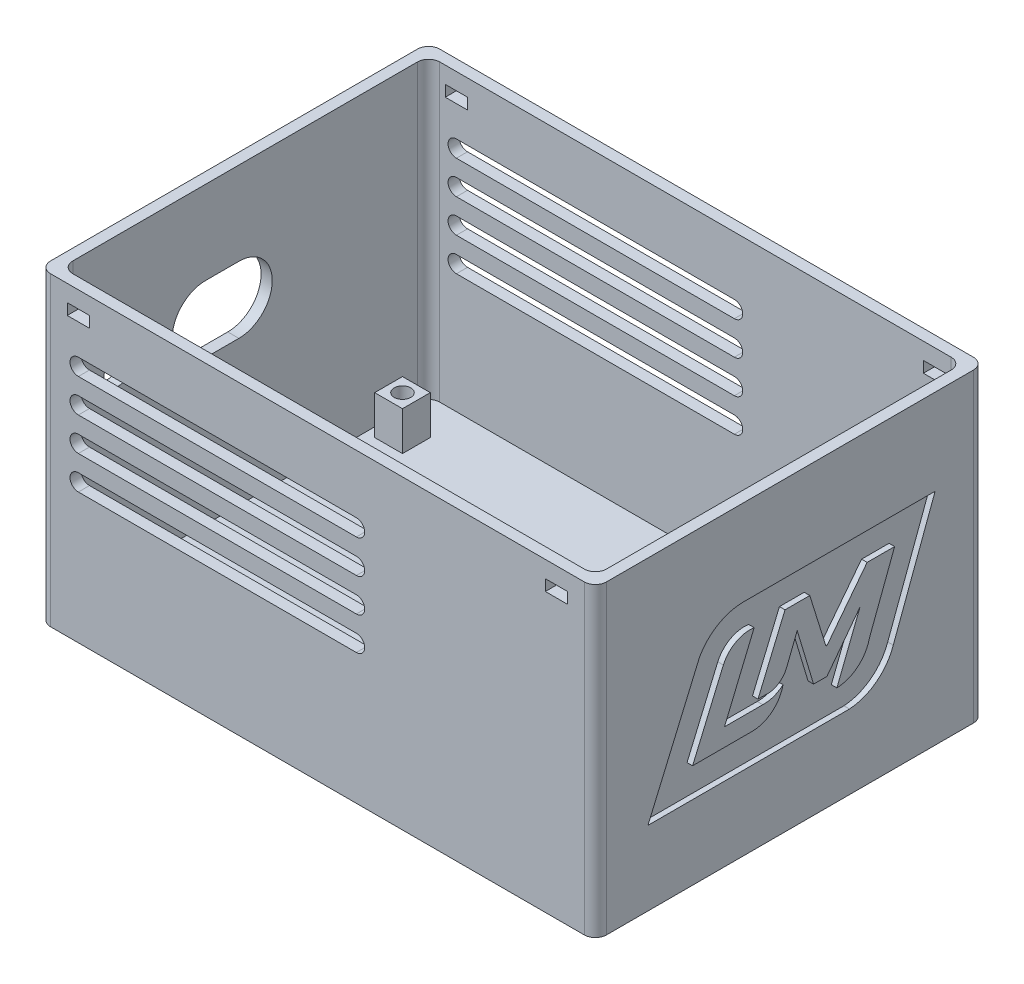
from build123d import *

# Parameters (mm, degrees)
SKETCH1_W           = 100
SKETCH1_H           = 70
BOSS_EXTRUDE1_DEPTH = 2
SKETCH3_W           = 100
SKETCH3_H           = 70
SKETCH3_W_2         = 96
SKETCH3_H_2         = 66
BOSS_EXTRUDE2_DEPTH = 55
FILLET1_R           = 2
SKETCH5_W           = 5
SKETCH5_H           = 5
BOSS_EXTRUDE3_DEPTH = 7
SKETCH6_R           = 1.5
CUT_EXTRUDE1_DEPTH  = 5
CUT_EXTRUDE2_DEPTH  = 2
BOSS_EXTRUDE4_DEPTH = 25
FILLET2_R           = 1
CUT_EXTRUDE3_DEPTH  = 103.102889283
CUT_EXTRUDE4_DEPTH  = 1
CUT_EXTRUDE5_DEPTH  = 1
SKETCH17_R          = 2.6
CUT_EXTRUDE6_DEPTH  = 2
CUT_EXTRUDE7_DEPTH  = 1
SKETCH20_W          = 4
SKETCH20_H          = 2
CUT_EXTRUDE8_DEPTH  = 103.102889332


with BuildPart() as part:
    # Sketch1 → Boss-Extrude1 (new body)
    with BuildSketch(Plane(origin=(0, 0, 0), x_dir=(1, 0, 0), z_dir=(0, 1, 0))):
        Rectangle(SKETCH1_W, SKETCH1_H)
    extrude(amount=BOSS_EXTRUDE1_DEPTH)

    # Sketch3 → Boss-Extrude2 (add)
    with BuildSketch(Plane.XZ):
        Rectangle(SKETCH3_W, SKETCH3_H)
        Rectangle(SKETCH3_W_2, SKETCH3_H_2, mode=Mode.SUBTRACT)
    extrude(amount=-BOSS_EXTRUDE2_DEPTH)

    # Fillet1
    fillet1_edges = [part.edges().sort_by_distance(p)[0] for p in [
        (48, 28.5, 33),
        (-48, 28.5, 33),
        (-48, 28.5, -33),
        (48, 28.5, -33),
        (50, 27.5, 35),
        (-50, 27.5, 35),
        (-50, 27.5, -35),
        (50, 27.5, -35),
    ]]
    fillet(fillet1_edges, radius=FILLET1_R)

    # Sketch5 → Boss-Extrude3 (add)
    with BuildSketch(Plane(origin=(0, 2, 0), x_dir=(1, 0, 0), z_dir=(0, 1, 0))):
        with Locations((-43.83, 24.13)):
            Rectangle(SKETCH5_W, SKETCH5_H)
        with Locations((25, 24.13)):
            Rectangle(SKETCH5_W, SKETCH5_H)
        with Locations((25, -24.13)):
            Rectangle(SKETCH5_W, SKETCH5_H)
        with Locations((-43.83, -24.13)):
            Rectangle(SKETCH5_W, SKETCH5_H)
    extrude(amount=BOSS_EXTRUDE3_DEPTH)

    # Sketch6 → Cut-Extrude1 (cut)
    with BuildSketch(Plane(origin=(0, 9, 0), x_dir=(1, 0, 0), z_dir=(0, 1, 0))):
        with Locations(Location((-43.83, 24.13, 0), (0, 0, 270))):
            Circle(SKETCH6_R)
        with Locations(Location((25, 24.13, 0), (0, 0, 90))):
            Circle(SKETCH6_R)
        with Locations(Location((25, -24.13, 0), (0, 0, 270))):
            Circle(SKETCH6_R)
        with Locations(Location((-43.83, -24.13, 0), (0, 0, 90))):
            Circle(SKETCH6_R)
    extrude(amount=-CUT_EXTRUDE1_DEPTH, mode=Mode.SUBTRACT)

    # Sketch7 → Cut-Extrude2 (cut)
    with BuildSketch(Plane.ZY.offset(50)):
        with BuildLine():
            Line((1.13, 40), (7.13, 40))
            ThreePointArc((7.13, 40), (13.13, 34), (7.13, 28))
            Line((7.13, 28), (1.13, 28))
            ThreePointArc((1.13, 28), (-4.87, 34), (1.13, 40))
        make_face()
    extrude(amount=-CUT_EXTRUDE2_DEPTH, mode=Mode.SUBTRACT)

    # Sketch8 → Boss-Extrude4 (add)
    with BuildSketch(Plane(origin=(0, 2, 0), x_dir=(1, 0, 0), z_dir=(0, 1, 0))):
        Polygon((31, 24.13), (48, 24.13), (48, 26.13), (29, 26.13), (29, -3.87), (48, -3.87), (48, -1.87), (31, -1.87), align=None)
    extrude(amount=BOSS_EXTRUDE4_DEPTH)

    # Fillet2
    fillet2_edges = [part.edges().sort_by_distance(p)[0] for p in [
        (29, 14.5, -26.13),
        (29, 14.5, 3.87),
        (48, 14.5, 3.87),
        (48, 14.5, 1.87),
        (31, 14.5, 1.87),
        (31, 14.5, -24.13),
        (48, 14.5, -24.13),
        (48, 14.5, -26.13),
    ]]
    fillet(fillet2_edges, radius=FILLET2_R)

    # Sketch12 → Cut-Extrude3 (cut, through all)
    with BuildSketch(Plane.XY.offset(35)):
        with BuildLine():
            Line((-43, 41.5), (7, 41.5))
            ThreePointArc((7, 41.5), (8.5, 43), (7, 44.5))
            Line((7, 44.5), (-43, 44.5))
            ThreePointArc((-43, 44.5), (-44.5, 43), (-43, 41.5))
        make_face()
        with BuildLine():
            Line((-43, 35.5), (7, 35.5))
            ThreePointArc((7, 35.5), (8.5, 37), (7, 38.5))
            Line((7, 38.5), (-43, 38.5))
            ThreePointArc((-43, 38.5), (-44.5, 37), (-43, 35.5))
        make_face()
        with BuildLine():
            Line((-43, 29.5), (7, 29.5))
            ThreePointArc((7, 29.5), (8.5, 31), (7, 32.5))
            Line((7, 32.5), (-43, 32.5))
            ThreePointArc((-43, 32.5), (-44.5, 31), (-43, 29.5))
        make_face()
        with BuildLine():
            Line((-43, 23.5), (7, 23.5))
            ThreePointArc((7, 23.5), (8.5, 25), (7, 26.5))
            Line((7, 26.5), (-43, 26.5))
            ThreePointArc((-43, 26.5), (-44.5, 25), (-43, 23.5))
        make_face()
    extrude(amount=-CUT_EXTRUDE3_DEPTH, mode=Mode.SUBTRACT)

    # Sketch13 → Cut-Extrude4 (cut)
    # profile 1 of 3: a face of its own
    with BuildSketch(Plane.ZY.offset(50)):
        Polygon((15.900385645, 25.937709976), (16.797821543, 25.937709976), (16.797821543, 21.835145874), (18.208077953, 21.835145874), (18.208077953, 20.937709976), (15.900385645, 20.937709976), align=None)
    # profile 2 of 3: a face of its own
    with BuildSketch(Plane.ZY.offset(50)):
        with BuildLine():
            add(Edge.make_bspline(
                [(21.327068338, 26.065915105), (21.413999465, 26.063664302), (21.585621201, 26.059220708), (21.838014843, 26.022179883), (22.081242784, 25.96182717), (22.315195037, 25.877932532), (22.539285814, 25.768223679), (22.754305557, 25.635810926), (22.959484075, 25.478195064), (23.152718864, 25.299053009), (23.33130266, 25.104243847), (23.486045623, 24.89449715), (23.618004745, 24.675247665), (23.727372819, 24.445907907), (23.810676964, 24.204889589), (23.869134928, 23.953421585), (23.906691273, 23.691575437), (23.911010831, 23.5132939), (23.913206158, 23.422685938)],
                knots=[0, 0, 0, 0, 1.014329547, 2.002516266, 2.970391464, 3.935626869, 4.897733899, 5.877609409, 6.878433252, 7.912639331, 8.949961323, 9.958554974, 10.949718813, 11.932905612, 12.9188844, 13.919928257, 14.942845884, 16, 16, 16, 16], degree=3))
            add(Edge.make_bspline(
                [(23.913206158, 23.422685938), (23.91086823, 23.333098919), (23.906261267, 23.156564823), (23.870668142, 22.89713169), (23.811225739, 22.648357433), (23.729334498, 22.409678945), (23.621949947, 22.182252304), (23.492564172, 21.964625422), (23.337762926, 21.758817928), (23.16319242, 21.564940267), (22.971005442, 21.388954688), (22.767448923, 21.233867701), (22.553462761, 21.10245284), (22.329360165, 20.9947703), (22.094660555, 20.911201847), (21.84994367, 20.852238231), (21.595224652, 20.816404851), (21.422003367, 20.81182798), (21.334079556, 20.809504848)],
                knots=[0, 0, 0, 0, 1.051557043, 2.072126891, 3.067553643, 4.050577992, 5.02905126, 6.015227836, 7.017913613, 8.04756643, 9.074058332, 10.072836633, 11.047628519, 12.017157415, 12.98668631, 13.966869689, 14.968021931, 16, 16, 16, 16], degree=3))
            add(Edge.make_bspline(
                [(21.334079556, 20.809504848), (21.242121791, 20.811588812), (21.061437353, 20.815683517), (20.797004869, 20.854622287), (20.5436557, 20.913277678), (20.303518126, 21.000817702), (20.07414655, 21.110250092), (19.857226233, 21.245022643), (19.652830074, 21.40491263), (19.462130523, 21.585825213), (19.289356269, 21.783783259), (19.136849099, 21.99290838), (19.008205918, 22.211603043), (18.903422019, 22.439969604), (18.820814603, 22.676588818), (18.762544457, 22.922901765), (18.728122891, 23.178317698), (18.723328166, 23.351801306), (18.720898466, 23.439713181)],
                knots=[0, 0, 0, 0, 1.067978421, 2.098431617, 3.099715153, 4.085208694, 5.062210972, 6.048429807, 7.046490867, 8.072918869, 9.098532598, 10.095778865, 11.076610158, 12.041847152, 13.011192615, 13.984257998, 14.978533688, 16, 16, 16, 16], degree=3))
            add(Edge.make_bspline(
                [(18.720898466, 23.439713181), (18.721661046, 23.498855689), (18.72317655, 23.616391825), (18.741432391, 23.790574379), (18.767715554, 23.961357123), (18.806587106, 24.128059145), (18.853806105, 24.291856448), (18.914984989, 24.451224368), (18.984623115, 24.607865393), (19.065988709, 24.759929395), (19.156459382, 24.906017258), (19.255170942, 25.045439861), (19.362371596, 25.176511381), (19.477716016, 25.300093166), (19.601601695, 25.415372903), (19.732399045, 25.523982537), (19.872644772, 25.623037012), (20.019269338, 25.714955434), (20.171446106, 25.798075669), (20.32855558, 25.868825127), (20.487360994, 25.930609423), (20.649983775, 25.979372322), (20.814681129, 26.019089193), (20.983212514, 26.045354641), (21.154055345, 26.063609977), (21.269260475, 26.065144905), (21.327068338, 26.065915105)],
                knots=[0, 0, 0, 0, 1.034744296, 2.056386356, 3.06226378, 4.057406941, 5.050368692, 6.043467995, 7.042652155, 8.049140477, 9.059438543, 10.048523776, 11.036952808, 12.020949711, 13.004946614, 13.997082645, 14.994316842, 16.007702937, 17.024872941, 18.026463647, 19.021641123, 20.005082605, 20.995858141, 21.984425357, 22.988620895, 24, 24, 24, 24], degree=3))
        make_face()
        with BuildLine():
            add(Edge.make_bspline(
                [(21.313045902, 25.168479207), (21.254541264, 25.166909396), (21.139076521, 25.163811218), (20.969710771, 25.14020729), (20.80711367, 25.102509133), (20.652186558, 25.047903814), (20.504257967, 24.978405102), (20.363065665, 24.894255834), (20.230564875, 24.792563472), (20.104988826, 24.678787427), (19.99155153, 24.552014765), (19.8913261, 24.416156298), (19.807453558, 24.271438907), (19.737209779, 24.119206982), (19.684331782, 23.957748716), (19.646668369, 23.788328829), (19.622866499, 23.610655402), (19.619866243, 23.489535658), (19.618334363, 23.427693951)],
                knots=[0, 0, 0, 0, 1.033739768, 2.040188636, 3.016340934, 3.979330865, 4.937572243, 5.900995986, 6.878200029, 7.884839167, 8.891893314, 9.879764717, 10.863503415, 11.843163062, 12.837761627, 13.859916423, 14.907309254, 16, 16, 16, 16], degree=3))
            add(Edge.make_bspline(
                [(19.618334363, 23.427693951), (19.620365402, 23.359159427), (19.624345902, 23.224843117), (19.652353184, 23.028906103), (19.700270856, 22.843863039), (19.769463042, 22.670618945), (19.855279505, 22.507250073), (19.961849933, 22.355758743), (20.087448388, 22.215237894), (20.18420842, 22.133195969), (20.233318338, 22.09155613)],
                knots=[0, 0, 0, 0, 1.078454662, 2.113592447, 3.107694534, 4.079536787, 5.043276885, 6.005368276, 6.987637804, 8, 8, 8, 8], degree=3))
            add(Edge.make_bspline(
                [(20.233318338, 22.09155613), (20.273548736, 22.060794217), (20.353103134, 21.999963461), (20.480089273, 21.921996368), (20.610859993, 21.855170792), (20.74640212, 21.801176517), (20.886429398, 21.758705528), (21.030922625, 21.728963792), (21.179677065, 21.710298281), (21.280271789, 21.708067399), (21.331074748, 21.706940746)],
                knots=[0, 0, 0, 0, 1.023928204, 2.024787132, 3.009472467, 3.9914905, 4.972207045, 5.96565515, 6.972602802, 8, 8, 8, 8], degree=3))
            add(Edge.make_bspline(
                [(21.331074748, 21.706940746), (21.388573397, 21.708523867), (21.501703797, 21.711638707), (21.667916712, 21.734952058), (21.827153733, 21.774406665), (21.980403417, 21.828532967), (22.12722386, 21.898904295), (22.26689751, 21.98566361), (22.399669254, 22.087745618), (22.525085321, 22.203015792), (22.639721534, 22.330287851), (22.739737814, 22.466870973), (22.826277084, 22.609755824), (22.895060143, 22.760964722), (22.95002723, 22.919070326), (22.987237344, 23.084772851), (23.011240286, 23.257389209), (23.014241387, 23.374860741), (23.015770261, 23.434705169)],
                knots=[0, 0, 0, 0, 1.026359118, 2.019393844, 2.989460624, 3.950973911, 4.916101784, 5.890408035, 6.881132271, 7.902007068, 8.92769091, 9.933912415, 10.920395702, 11.90457117, 12.894218921, 13.903490204, 14.931958862, 16, 16, 16, 16], degree=3))
            add(Edge.make_bspline(
                [(23.015770261, 23.434705169), (23.014188488, 23.494205474), (23.011075009, 23.611322751), (22.987720625, 23.783495314), (22.948516228, 23.948466311), (22.894227391, 24.106505158), (22.824903421, 24.257766792), (22.739177298, 24.401719286), (22.637349827, 24.538223475), (22.521764559, 24.666349133), (22.395957098, 24.784088407), (22.260890219, 24.886264693), (22.120343244, 24.975052638), (21.971091339, 25.044605528), (21.816188074, 25.100018168), (21.654688221, 25.140824832), (21.485980089, 25.163645399), (21.371204459, 25.166853575), (21.313045902, 25.168479207)],
                knots=[0, 0, 0, 0, 1.055025985, 2.07665775, 3.074803781, 4.057872707, 5.035505728, 6.020516407, 7.023567878, 8.050795229, 9.077271434, 10.074415901, 11.050397877, 12.019801805, 12.988065821, 13.964604439, 14.968634123, 16, 16, 16, 16], degree=3))
        make_face(mode=Mode.SUBTRACT)
    # profile 3 of 3: a face of its own
    with BuildSketch(Plane.ZY.offset(50)):
        with BuildLine():
            Line((29.392973786, 25.14243754), (28.713887248, 24.492397476))
            add(Edge.make_bspline(
                [(28.713887248, 24.492397476), (28.660122782, 24.546226362), (28.554628023, 24.651847522), (28.382104541, 24.789320721), (28.203422574, 24.906200117), (28.017994007, 25.002306532), (27.825560537, 25.076855023), (27.626501917, 25.130181944), (27.420494305, 25.161811045), (27.281036347, 25.166239011), (27.210481799, 25.168479207)],
                knots=[0, 0, 0, 0, 1.075575784, 2.110457258, 3.113929901, 4.09197124, 5.059417775, 6.02750972, 7.002078037, 8, 8, 8, 8], degree=3))
            add(Edge.make_bspline(
                [(27.210481799, 25.168479207), (27.149313164, 25.166909512), (27.029203186, 25.163827278), (26.852713141, 25.140421003), (26.684066093, 25.101321873), (26.522465282, 25.047156556), (26.368897337, 24.97667036), (26.222472458, 24.890951157), (26.084091744, 24.789343186), (25.954844844, 24.673772583), (25.837165126, 24.547592818), (25.734424518, 24.412535851), (25.646911592, 24.27111903), (25.574870606, 24.122618846), (25.52005525, 23.967263216), (25.480924259, 23.805164922), (25.45608581, 23.636795043), (25.453153131, 23.521931367), (25.451667697, 23.463751643)],
                knots=[0, 0, 0, 0, 1.075001177, 2.110859044, 3.123021556, 4.114053297, 5.101481495, 6.087880186, 7.091499647, 8.114004866, 9.131394192, 10.11971144, 11.092043119, 12.050101265, 13.015322563, 13.981809771, 14.977764287, 16, 16, 16, 16], degree=3))
            add(Edge.make_bspline(
                [(25.451667697, 23.463751643), (25.453053239, 23.40355824), (25.455782946, 23.284968997), (25.482004874, 23.110934184), (25.522404267, 22.943500153), (25.581538207, 22.783909226), (25.654314179, 22.629975229), (25.746606101, 22.484680011), (25.854227719, 22.345804755), (25.976986726, 22.215767358), (26.110516824, 22.095904173), (26.255134265, 21.992507105), (26.406438899, 21.903297754), (26.566872791, 21.832646831), (26.733651283, 21.77592188), (26.908465987, 21.735925922), (27.090923263, 21.71138854), (27.215412217, 21.708438102), (27.278590774, 21.706940746)],
                knots=[0, 0, 0, 0, 1.022067601, 2.013613092, 2.983553406, 3.943623673, 4.90013463, 5.87121881, 6.861774014, 7.881098904, 8.905697761, 9.905387765, 10.89678721, 11.884561068, 12.87834324, 13.885584958, 14.926927371, 16, 16, 16, 16], degree=3))
            add(Edge.make_bspline(
                [(27.278590774, 21.706940746), (27.319686085, 21.707311541), (27.400365325, 21.708039496), (27.518708021, 21.71985625), (27.632051899, 21.736749674), (27.740835909, 21.759114561), (27.843961624, 21.790764889), (27.94285689, 21.82777605), (28.036942268, 21.8714566), (28.125707636, 21.923313598), (28.210474082, 21.981438956), (28.290448175, 22.047946724), (28.367032754, 22.1213374), (28.439332938, 22.202507552), (28.506125025, 22.292182939), (28.569548866, 22.388715656), (28.628878267, 22.493063731), (28.663934445, 22.566749056), (28.681835966, 22.604376643)],
                knots=[0, 0, 0, 0, 1.109579412, 2.178351274, 3.208885622, 4.204702371, 5.174744997, 6.119429583, 7.05542196, 7.97267548, 8.893247984, 9.828544973, 10.778894627, 11.756245826, 12.760884819, 13.796418446, 14.874735809, 16, 16, 16, 16], degree=3))
            Line((28.681835966, 22.604376643), (27.246539492, 22.604376643))
            Line((27.246539492, 22.604376643), (27.246539492, 23.50181254))
            Line((27.246539492, 23.50181254), (29.739528274, 23.50181254))
            Line((29.739528274, 23.50181254), (29.746539492, 23.288471194))
            add(Edge.make_bspline(
                [(29.746539492, 23.288471194), (29.745638602, 23.233679723), (29.743838431, 23.124194562), (29.727386757, 22.961189808), (29.700134809, 22.800346975), (29.662878787, 22.641827607), (29.616187568, 22.484854112), (29.556641647, 22.330929642), (29.486913738, 22.17901033), (29.408788563, 22.029741718), (29.320998344, 21.886514426), (29.226479283, 21.750897088), (29.126578813, 21.623124427), (29.019124141, 21.504976638), (28.905788512, 21.395461226), (28.786348825, 21.294999511), (28.660382626, 21.20350649), (28.52855721, 21.120209255), (28.390121703, 21.047204143), (28.245837223, 20.983699381), (28.095921622, 20.929766127), (27.93998785, 20.885552592), (27.778342749, 20.851438332), (27.610982853, 20.828046139), (27.437816248, 20.812150881), (27.320361003, 20.810397522), (27.260561927, 20.809504848)],
                knots=[0, 0, 0, 0, 1.006889344, 2.011981806, 3.007738725, 4.003571281, 5.003404394, 6.015442001, 7.03424805, 8.074616296, 9.110249922, 10.119753985, 11.111721717, 12.089233633, 13.052717867, 14.006597561, 14.955430184, 15.912305663, 16.870361111, 17.829300583, 18.807640451, 19.796414044, 20.806216501, 21.841577364, 22.90109906, 24, 24, 24, 24], degree=3))
            add(Edge.make_bspline(
                [(27.260561927, 20.809504848), (27.196760368, 20.81038638), (27.070286647, 20.81213384), (26.8832783, 20.828499988), (26.701695181, 20.855511259), (26.525492, 20.892893936), (26.354259648, 20.939419663), (26.188292329, 20.997820456), (26.02792949, 21.067290046), (25.872690921, 21.145988852), (25.724560739, 21.235240152), (25.583870928, 21.333478916), (25.4513894, 21.441337068), (25.325759132, 21.557009039), (25.209915334, 21.683338057), (25.09954096, 21.816229187), (24.999983271, 21.960556343), (24.906961581, 22.111640399), (24.824320368, 22.269418041), (24.75204944, 22.430971091), (24.690416833, 22.595364155), (24.641818033, 22.763362704), (24.602360358, 22.933795309), (24.574127652, 23.107403144), (24.558183323, 23.284164477), (24.555554821, 23.402957248), (24.554231799, 23.46275004)],
                knots=[0, 0, 0, 0, 1.084149091, 2.14910686, 3.187506334, 4.202448172, 5.208724393, 6.201130722, 7.189831603, 8.176984443, 9.156919086, 10.126598231, 11.090766514, 12.05840148, 13.026036446, 14.001772938, 14.991905635, 16.003017641, 17.015720547, 18.016462227, 19.009322657, 19.99686681, 20.986544154, 21.980959929, 22.983742515, 24, 24, 24, 24], degree=3))
            add(Edge.make_bspline(
                [(24.554231799, 23.46275004), (24.556003608, 23.544320186), (24.559502406, 23.705397041), (24.591906585, 23.942664269), (24.642419872, 24.172196638), (24.714911525, 24.393158207), (24.807935433, 24.605853352), (24.92017383, 24.810781385), (25.054064777, 25.007724486), (25.157705565, 25.129659619), (25.210281479, 25.191516066)],
                knots=[0, 0, 0, 0, 1.034044851, 2.041932006, 3.031217818, 4.011390712, 4.986069675, 5.97149666, 6.970960976, 8, 8, 8, 8], degree=3))
            add(Edge.make_bspline(
                [(25.210281479, 25.191516066), (25.24292535, 25.227301896), (25.307722942, 25.298336229), (25.411301777, 25.39703988), (25.517507399, 25.489824965), (25.627810775, 25.574724032), (25.741632059, 25.653595563), (25.859298849, 25.724961049), (25.980193893, 25.791092805), (26.105260026, 25.848613892), (26.233842508, 25.900186345), (26.366510813, 25.943823891), (26.50227128, 25.982476385), (26.642326074, 26.01188102), (26.785260307, 26.036366956), (26.932088575, 26.052778712), (27.08241076, 26.064807361), (27.184081126, 26.065542936), (27.235521863, 26.065915105)],
                knots=[0, 0, 0, 0, 1.020590567, 2.025856924, 3.013483481, 3.991664875, 4.957826714, 5.930500614, 6.890802512, 7.860442893, 8.829981142, 9.809047939, 10.802672283, 11.803273349, 12.823572789, 13.857849586, 14.916166035, 16, 16, 16, 16], degree=3))
            add(Edge.make_bspline(
                [(27.235521863, 26.065915105), (27.289294134, 26.065085844), (27.396281209, 26.063435919), (27.555353272, 26.052019517), (27.712214922, 26.034406699), (27.866205129, 26.007986466), (28.017840684, 25.975404821), (28.166336686, 25.933659668), (28.312661887, 25.886229656), (28.407919039, 25.848414946), (28.455473786, 25.829536899)],
                knots=[0, 0, 0, 0, 1.03180557, 2.052914215, 3.058998889, 4.059601663, 5.049854447, 6.033765722, 7.018406786, 8, 8, 8, 8], degree=3))
            add(Edge.make_bspline(
                [(28.455473786, 25.829536899), (28.495485224, 25.812090186), (28.57686738, 25.776604054), (28.695268387, 25.711680511), (28.81395868, 25.639705312), (28.93165753, 25.558046877), (29.048185598, 25.466857945), (29.164759561, 25.36757883), (29.280189389, 25.25905188), (29.354892108, 25.1818124), (29.392973786, 25.14243754)],
                knots=[0, 0, 0, 0, 0.894392155, 1.819168899, 2.76525314, 3.739198753, 4.75366411, 5.797420238, 6.877176959, 8, 8, 8, 8], degree=3))
        make_face()
    extrude(amount=-CUT_EXTRUDE4_DEPTH, mode=Mode.SUBTRACT)

    # Sketch16 → Cut-Extrude5 (cut)
    with BuildSketch(Plane.ZY.offset(50)):
        with BuildLine():
            Line((13.819956959, 25.969761258), (13.819956959, 20.969761258))
            ThreePointArc((13.819956959, 20.969761258), (14.405743397, 19.555547696), (15.819956959, 18.969761258))
            Line((15.819956959, 18.969761258), (29.819956959, 18.969761258))
            ThreePointArc((29.819956959, 18.969761258), (31.234170522, 19.555547696), (31.819956959, 20.969761258))
            Line((31.819956959, 20.969761258), (31.819956959, 25.969761258))
            ThreePointArc((31.819956959, 25.969761258), (31.234170522, 27.383974821), (29.819956959, 27.969761258))
            Line((29.819956959, 27.969761258), (15.819956959, 27.969761258))
            ThreePointArc((15.819956959, 27.969761258), (14.405743397, 27.383974821), (13.819956959, 25.969761258))
        make_face()
        with BuildLine():
            Line((15.819956959, 26.969761258), (29.819956959, 26.969761258))
            ThreePointArc((29.819956959, 26.969761258), (30.527063741, 26.67686804), (30.819956959, 25.969761258))
            Line((30.819956959, 25.969761258), (30.819956959, 20.969761258))
            ThreePointArc((30.819956959, 20.969761258), (30.527063741, 20.262654477), (29.819956959, 19.969761258))
            Line((29.819956959, 19.969761258), (15.819956959, 19.969761258))
            ThreePointArc((15.819956959, 19.969761258), (15.112850178, 20.262654477), (14.819956959, 20.969761258))
            Line((14.819956959, 20.969761258), (14.819956959, 25.969761258))
            ThreePointArc((14.819956959, 25.969761258), (15.112850178, 26.67686804), (15.819956959, 26.969761258))
        make_face(mode=Mode.SUBTRACT)
    extrude(amount=-CUT_EXTRUDE5_DEPTH, mode=Mode.SUBTRACT)

    # Sketch17 → Cut-Extrude6 (cut)
    with BuildSketch(Plane.ZY.offset(50)):
        with Locations((22.819956959, 34)):
            Circle(SKETCH17_R)
    extrude(amount=-CUT_EXTRUDE6_DEPTH, mode=Mode.SUBTRACT)

    # Sketch19 → Cut-Extrude7 (cut)
    with BuildSketch(Plane(origin=(50, 0, 0), x_dir=(0, 0, -1), z_dir=(1, 0, 0))):
        with BuildLine():
            Line((26.110310784, 39.561095617), (-8.439517259, 39.561095617))
            ThreePointArc((-8.439517259, 39.561095617), (-12.962003459, 38.294937056), (-16.252914783, 34.944423425))
            Line((-16.252914783, 34.944423425), (-25.549438608, 13.342615981))
            Line((-25.549438608, 13.342615981), (10.706291518, 13.342615981))
            ThreePointArc((10.706291518, 13.342615981), (15.553853165, 15.15855546), (18.58520651, 19.354671164))
            Line((18.58520651, 19.354671164), (26.110310784, 39.561095617))
        make_face()
        with BuildLine():
            Line((-6.438114675, 34.593979897), (-11.787047742, 21.811603083))
            Line((-11.787047742, 21.811603083), (-4.904229457, 21.811603083))
            ThreePointArc((-4.904229457, 21.811603083), (-2.948777203, 22.103803393), (-1.246503169, 23.109505959))
            ThreePointArc((-1.246503169, 23.109505959), (-3.253163269, 19.865276329), (-6.855937429, 18.611590164))
            Line((-6.855937429, 18.611590164), (-17.515536588, 18.611590164))
            Line((-17.515536588, 18.611590164), (-11.983339556, 31.54253851))
            ThreePointArc((-11.983339556, 31.54253851), (-9.720527691, 33.994693133), (-6.438114675, 34.593979897))
        make_face(mode=Mode.SUBTRACT)
        with BuildLine():
            Line((-0.892509009, 34.593979897), (-5.747693063, 23.109505959))
            Line((-5.747693063, 23.109505959), (-4.518488271, 23.109505959))
            ThreePointArc((-4.518488271, 23.109505959), (-2.15228711, 23.618823786), (-0.595878861, 25.472443473))
            Line((-0.595878861, 25.472443473), (1.30215795, 30.262726854))
            Line((1.30215795, 30.262726854), (4.248634143, 20.447165059))
            Line((4.248634143, 20.447165059), (6.652814103, 20.447165059))
            Line((6.652814103, 20.447165059), (12.61452231, 28.308495829))
            Line((12.61452231, 28.308495829), (8.437925444, 17.76756088))
            ThreePointArc((8.437925444, 17.76756088), (12.191158486, 19.17915515), (14.287204196, 22.597626889))
            Line((14.287204196, 22.597626889), (18.828654002, 34.593979897))
            Line((18.828654002, 34.593979897), (13.878983989, 34.593979897))
            Line((13.878983989, 34.593979897), (6.652814103, 25.242589718))
            Line((6.652814103, 25.242589718), (6.479330253, 25.242589718))
            Line((6.479330253, 25.242589718), (3.560351512, 34.593979897))
            Line((3.560351512, 34.593979897), (-0.892509009, 34.593979897))
        make_face(mode=Mode.SUBTRACT)
    extrude(amount=-CUT_EXTRUDE7_DEPTH, mode=Mode.SUBTRACT)

    # Sketch20 → Cut-Extrude8 (cut, through all)
    with BuildSketch(Plane.XY.offset(35)):
        with Locations((-43, 51)):
            Rectangle(SKETCH20_W, SKETCH20_H)
        with Locations((43, 51)):
            Rectangle(SKETCH20_W, SKETCH20_H)
    extrude(amount=-CUT_EXTRUDE8_DEPTH, mode=Mode.SUBTRACT)


solid = part.part
